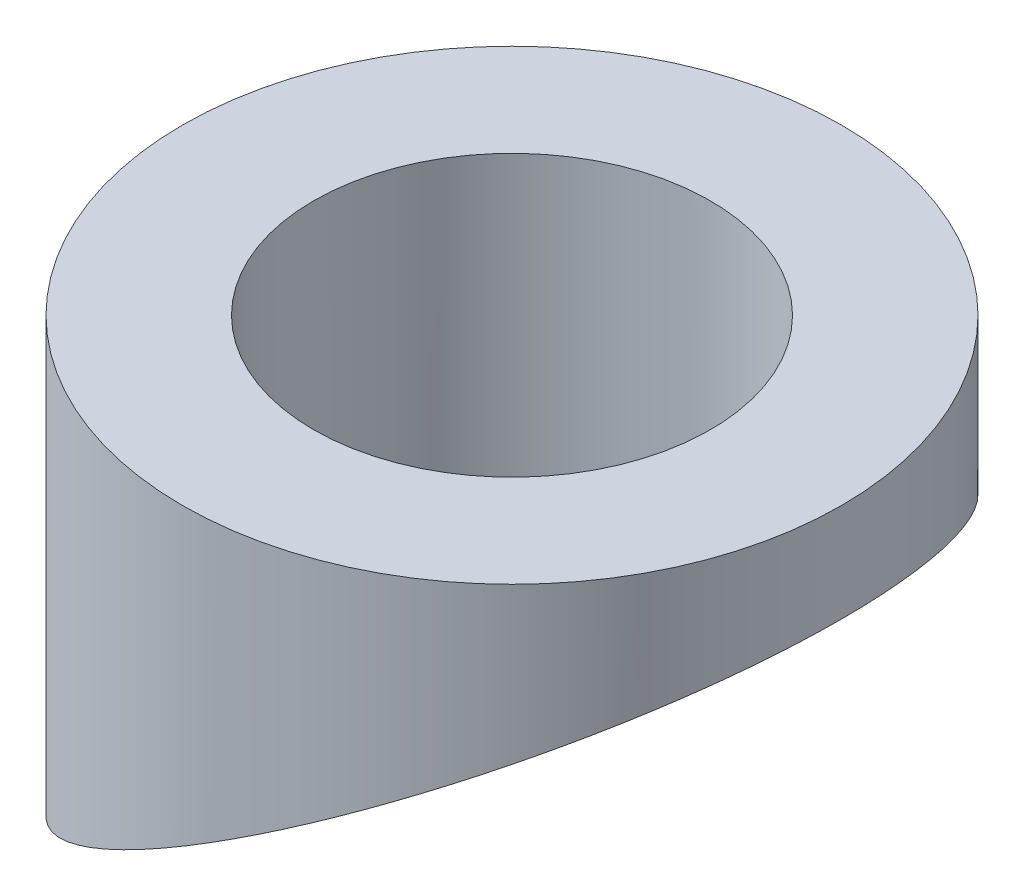
from build123d import *

# Parameters (mm, degrees)
SKETCH1_R           = 10.05
SKETCH1_R_2         = 6.05
BOSS_EXTRUDE1_DEPTH = 15
CUT_EXTRUDE1_DEPTH  = 15


with BuildPart() as part:
    # Sketch1 → Boss-Extrude1 (new body)
    with BuildSketch(Plane(origin=(0, 0, 0), x_dir=(1, 0, 0), z_dir=(0, 1, 0))):
        with Locations(Location((0, 0, 0), (0, 0, 270))):
            Circle(SKETCH1_R)
        with Locations(Location((0, 0, 0), (0, 0, 270))):
            Circle(SKETCH1_R_2, mode=Mode.SUBTRACT)
    extrude(amount=BOSS_EXTRUDE1_DEPTH)

    # Sketch3 → Cut-Extrude1 (cut, symmetric)
    with BuildSketch(Plane.XY):
        Polygon((-10.05, 0), (10.05, 12), (10.05, 0), align=None)
    extrude(amount=CUT_EXTRUDE1_DEPTH, both=True, mode=Mode.SUBTRACT)


solid = part.part
